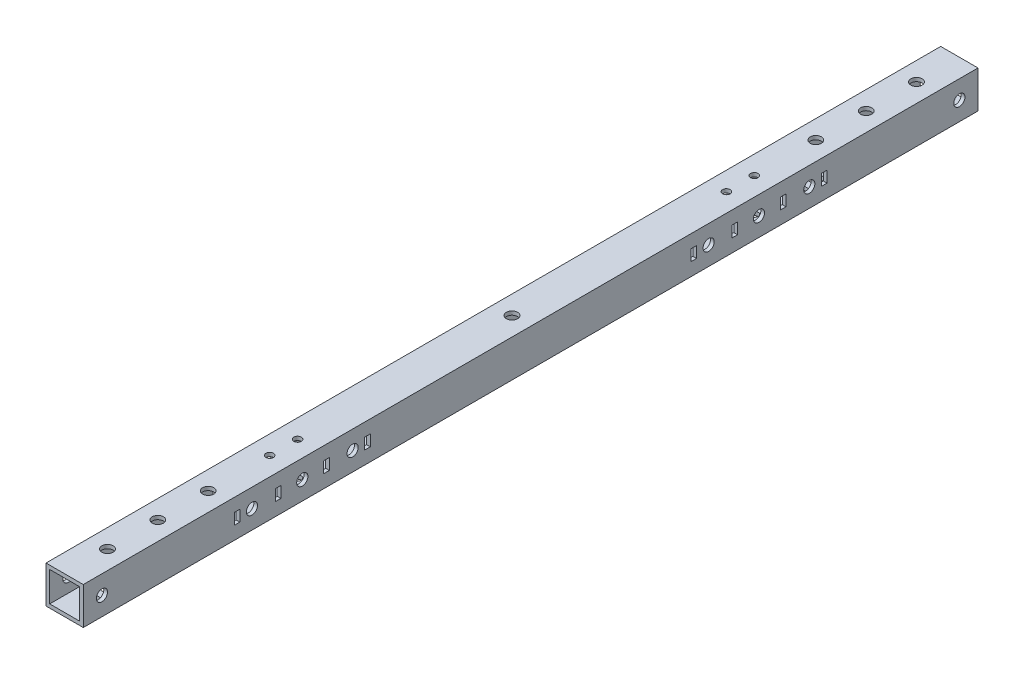
from build123d import *

# Parameters (mm, degrees)
SKETCH_1_W           = 20
SKETCH_1_H           = 20
SKETCH_1_W_2         = 16
SKETCH_1_H_2         = 16
EXTRUDE_1_DEPTH      = 480
SKETCH_2_R           = 3
CUT_EXTRUDE_1_DEPTH  = 450
SKETCH_3_R           = 3
CUT_EXTRUDE_2_DEPTH  = 10
SKETCH_4_R           = 3
CUT_EXTRUDE_3_DEPTH  = 85
SKETCH_5_R           = 3
CUT_EXTRUDE_4_DEPTH  = 10
SKETCH_6_R           = 3
CUT_EXTRUDE_5_DEPTH  = 27
SKETCH_8_R           = 3
CUT_EXTRUDE_6_DEPTH  = 54.24
SKETCH_9_R           = 3
CUT_EXTRUDE_7_DEPTH  = 54.24
CUT_EXTRUDE_START    = -10
SKETCH_10_W          = 6
SKETCH_10_H          = 3
CUT_EXTRUDE_8_DEPTH  = 20
SKETCH_11_W          = 3
SKETCH_11_H          = 6
CUT_EXTRUDE_9_DEPTH  = 20
SKETCH_12_R          = 2
CUT_EXTRUDE_10_DEPTH = 20


with BuildPart() as part:
    # 草图1 → 凸台-拉伸1 (new body)
    with BuildSketch(Plane.XY):
        Rectangle(SKETCH_1_W, SKETCH_1_H)
        Rectangle(SKETCH_1_W_2, SKETCH_1_H_2, mode=Mode.SUBTRACT)
    extrude(amount=EXTRUDE_1_DEPTH)

    # 草图2 → 切除-拉伸1 (cut)
    with BuildSketch(Plane(origin=(0, 10, 0), x_dir=(1, 0, 0), z_dir=(0, 1, 0))):
        with Locations(Location((0, -50, 0), (0, 0, 270))):
            Circle(SKETCH_2_R)
        with Locations(Location((0, -430, 0), (0, 0, 270))):
            Circle(SKETCH_2_R)
    extrude(amount=-CUT_EXTRUDE_1_DEPTH, mode=Mode.SUBTRACT)

    # 草图3 → 切除-拉伸2 (cut)
    with BuildSketch(Plane.XZ.offset(10)):
        with Locations(Location((0, 77, 0), (0, 0, 270))):
            Circle(SKETCH_3_R)
        with Locations(Location((0, 23, 0), (0, 0, 90))):
            Circle(SKETCH_3_R)
        with Locations(Location((0, 457, 0), (0, 0, 270))):
            Circle(SKETCH_3_R)
        with Locations(Location((0, 403, 0), (0, 0, 90))):
            Circle(SKETCH_3_R)
    extrude(amount=-CUT_EXTRUDE_2_DEPTH, mode=Mode.SUBTRACT)

    # 草图4 → 切除-拉伸3 (cut)
    with BuildSketch(Plane.XZ.offset(10)):
        with Locations(Location((0, 403, 0), (0, 0, 90))):
            Circle(SKETCH_4_R)
        with Locations(Location((0, 457, 0), (0, 0, 270))):
            Circle(SKETCH_4_R)
        with Locations(Location((0, 77, 0), (0, 0, 270))):
            Circle(SKETCH_4_R)
        with Locations(Location((0, 23, 0), (0, 0, 90))):
            Circle(SKETCH_4_R)
    extrude(amount=-CUT_EXTRUDE_3_DEPTH, mode=Mode.SUBTRACT)

    # 草图5 → 切除-拉伸4 (cut)
    with BuildSketch(Plane(origin=(10, 0, 0), x_dir=(0, 0, -1), z_dir=(1, 0, 0))):
        with Locations((-362.5, 0)):
            Circle(SKETCH_5_R)
        with Locations((-389.5, 0)):
            Circle(SKETCH_5_R)
        with Locations(Location((-335.5, 0, 0), (0, 0, 180))):
            Circle(SKETCH_5_R)
        with Locations((-144.5, 0)):
            Circle(SKETCH_5_R)
        with Locations(Location((-90.5, 0, 0), (0, 0, 180))):
            Circle(SKETCH_5_R)
        with Locations(Location((-117.5, 0, 0), (0, 0, 180))):
            Circle(SKETCH_5_R)
    extrude(amount=-CUT_EXTRUDE_4_DEPTH, mode=Mode.SUBTRACT)

    # 草图6 → 切除-拉伸5 (cut)
    with BuildSketch(Plane(origin=(10, 0, 0), x_dir=(0, 0, -1), z_dir=(1, 0, 0))):
        with Locations(Location((-335.5, 0, 0), (0, 0, 180))):
            Circle(SKETCH_6_R)
        with Locations((-362.5, 0)):
            Circle(SKETCH_6_R)
        with Locations((-389.5, 0)):
            Circle(SKETCH_6_R)
        with Locations(Location((-90.5, 0, 0), (0, 0, 180))):
            Circle(SKETCH_6_R)
        with Locations(Location((-117.5, 0, 0), (0, 0, 180))):
            Circle(SKETCH_6_R)
        with Locations((-144.5, 0)):
            Circle(SKETCH_6_R)
    extrude(amount=-CUT_EXTRUDE_5_DEPTH, mode=Mode.SUBTRACT)

    # 草图8 → 切除-拉伸6 (cut)
    with BuildSketch(Plane.ZY.offset(10)):
        with Locations(Location((10, 0, 0), (0, 0, 270))):
            Circle(SKETCH_8_R)
        with Locations(Location((470, 0, 0), (0, 0, 270))):
            Circle(SKETCH_8_R)
    extrude(amount=-CUT_EXTRUDE_6_DEPTH, mode=Mode.SUBTRACT)

    # 草图9 → 切除-拉伸7 (cut)
    with BuildSketch(Plane.XZ.offset(10)):
        with Locations(Location((0, 240, 0), (0, 0, 270))):
            Circle(SKETCH_9_R)
    extrude(amount=-CUT_EXTRUDE_7_DEPTH, mode=Mode.SUBTRACT)

    # 草图10 → 切除-拉伸8 (cut)
    with BuildSketch(Plane(origin=(0, 10, 0), x_dir=(1, 0, 0), z_dir=(0, 1, 0)).offset(CUT_EXTRUDE_START)):
        with Locations((0, -15)):
            Rectangle(SKETCH_10_W, SKETCH_10_H)
        with Locations((0, -37)):
            Rectangle(SKETCH_10_W, SKETCH_10_H)
        with Locations((0, -85)):
            Rectangle(SKETCH_10_W, SKETCH_10_H)
        with Locations((0, -63)):
            Rectangle(SKETCH_10_W, SKETCH_10_H)
        with Locations((0, -465)):
            Rectangle(SKETCH_10_W, SKETCH_10_H)
        with Locations((0, -443)):
            Rectangle(SKETCH_10_W, SKETCH_10_H)
        with Locations((0, -417)):
            Rectangle(SKETCH_10_W, SKETCH_10_H)
        with Locations((0, -395)):
            Rectangle(SKETCH_10_W, SKETCH_10_H)
    extrude(amount=-CUT_EXTRUDE_8_DEPTH, mode=Mode.SUBTRACT)

    # 草图11 → 切除-拉伸9 (cut)
    with BuildSketch(Plane.ZY.offset(10).offset(CUT_EXTRUDE_START)):
        with Locations((349.5, 0)):
            Rectangle(SKETCH_11_W, SKETCH_11_H)
        with Locations((327.5, 0)):
            Rectangle(SKETCH_11_W, SKETCH_11_H)
        with Locations((375.5, 0)):
            Rectangle(SKETCH_11_W, SKETCH_11_H)
        with Locations((397.5, 0)):
            Rectangle(SKETCH_11_W, SKETCH_11_H)
        with Locations((82.5, 0)):
            Rectangle(SKETCH_11_W, SKETCH_11_H)
        with Locations((104.5, 0)):
            Rectangle(SKETCH_11_W, SKETCH_11_H)
        with Locations((130.5, 0)):
            Rectangle(SKETCH_11_W, SKETCH_11_H)
        with Locations((152.5, 0)):
            Rectangle(SKETCH_11_W, SKETCH_11_H)
    extrude(amount=-CUT_EXTRUDE_9_DEPTH, mode=Mode.SUBTRACT)

    # 草图12 → 切除-拉伸10 (cut)
    with BuildSketch(Plane(origin=(0, 10, 0), x_dir=(1, 0, 0), z_dir=(0, 1, 0))):
        with Locations(Location((0, -355, 0), (0, 0, 180))):
            Circle(SKETCH_12_R)
        with Locations(Location((0, -370, 0), (0, 0, 180))):
            Circle(SKETCH_12_R)
        with Locations(Location((0, -110, 0), (0, 0, 180))):
            Circle(SKETCH_12_R)
        with Locations(Location((0, -125, 0), (0, 0, 180))):
            Circle(SKETCH_12_R)
    extrude(amount=-CUT_EXTRUDE_10_DEPTH, mode=Mode.SUBTRACT)


solid = part.part
